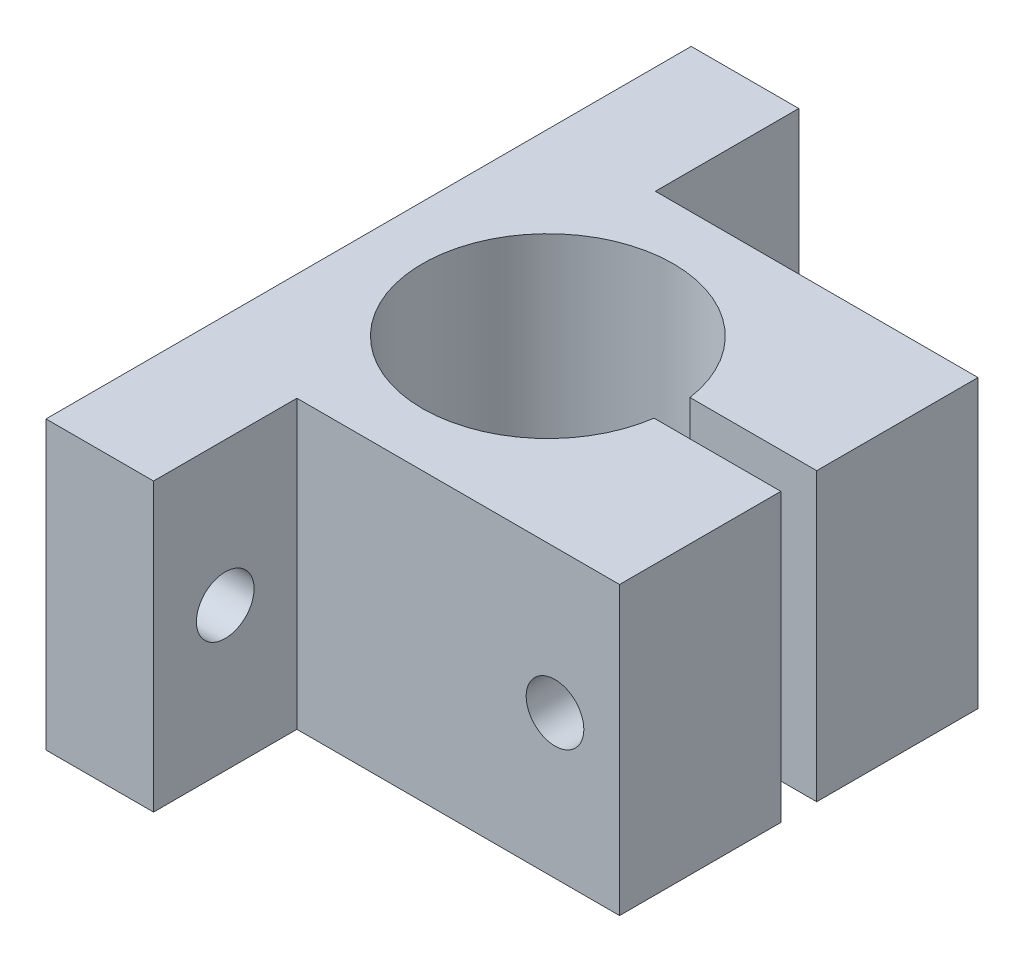
from build123d import *

# Parameters (mm, degrees)
SKETCH1_W              = 50.8
SKETCH1_H              = 57.15
BOSS_EXTRUDE1_DEPTH    = 12.7
SKETCH2_R              = 11.1125
CUT_EXTRUDE1_DEPTH     = 46.900442536
SKETCH11_W             = 12.7
SKETCH11_H             = 57.15
CUT_EXTRUDE4_DEPTH     = 46.900442536
SKETCH3_W              = 28.575
SKETCH3_H              = 12.7
CUT_EXTRUDE2_DEPTH     = 46.900442536
F_10_CLEARANCE_HOLE1_D = 5.1054
SKETCH6_W              = 3.175
SKETCH6_H              = 37.090012852
CUT_EXTRUDE3_DEPTH     = 24.13
F_10_CLEARANCE_HOLE2_D = 5.1054


with BuildPart() as part:
    # Sketch1 → Boss-Extrude1 (new, symmetric)
    with BuildSketch(Plane(origin=(0, 0, 0), x_dir=(1, 0, 0), z_dir=(0, 1, 0))):
        Rectangle(SKETCH1_W, SKETCH1_H)
    extrude(amount=BOSS_EXTRUDE1_DEPTH, both=True)

    # Sketch2 → Cut-Extrude1 (cut, through all)
    with BuildSketch(Plane(origin=(0, 12.7, 0), x_dir=(1, 0, 0), z_dir=(0, 1, 0))):
        with Locations(Location((-9.525, 0, 0), (0, 0, 270))):
            Circle(SKETCH2_R)
    extrude(amount=-CUT_EXTRUDE1_DEPTH, mode=Mode.SUBTRACT)

    # Sketch11 → Cut-Extrude4 (cut, through all)
    with BuildSketch(Plane(origin=(0, 12.7, 0), x_dir=(1, 0, 0), z_dir=(0, 1, 0))):
        with Locations((19.05, 0)):
            Rectangle(SKETCH11_W, SKETCH11_H)
    extrude(amount=-CUT_EXTRUDE4_DEPTH, mode=Mode.SUBTRACT)

    # Sketch3 → Cut-Extrude2 (cut, through all)
    with BuildSketch(Plane(origin=(0, 12.7, 0), x_dir=(1, 0, 0), z_dir=(0, 1, 0))):
        with Locations((-1.5875, 22.225)):
            Rectangle(SKETCH3_W, SKETCH3_H)
        with Locations((-1.5875, -22.225)):
            Rectangle(SKETCH3_W, SKETCH3_H)
    extrude(amount=-CUT_EXTRUDE2_DEPTH, mode=Mode.SUBTRACT)

    # #10 Clearance Hole1 (through all)
    with Locations(Plane(origin=(-15.875, 0, 0), x_dir=(0, 0, -1), z_dir=(1, 0, 0))):
        with Locations((22.225, 0), (-22.225, 0)):
            Hole(F_10_CLEARANCE_HOLE1_D / 2)

    # Sketch6 → Cut-Extrude3 (cut)
    with BuildSketch(Plane(origin=(12.7, 0, 0), x_dir=(0, 0, -1), z_dir=(1, 0, 0))):
        Rectangle(SKETCH6_W, SKETCH6_H)
    extrude(amount=-CUT_EXTRUDE3_DEPTH, mode=Mode.SUBTRACT)

    # #10 Clearance Hole2 (through all)
    with Locations(Plane.XY.offset(15.875)):
        with Locations((6.985, 0)):
            Hole(F_10_CLEARANCE_HOLE2_D / 2)


solid = part.part
